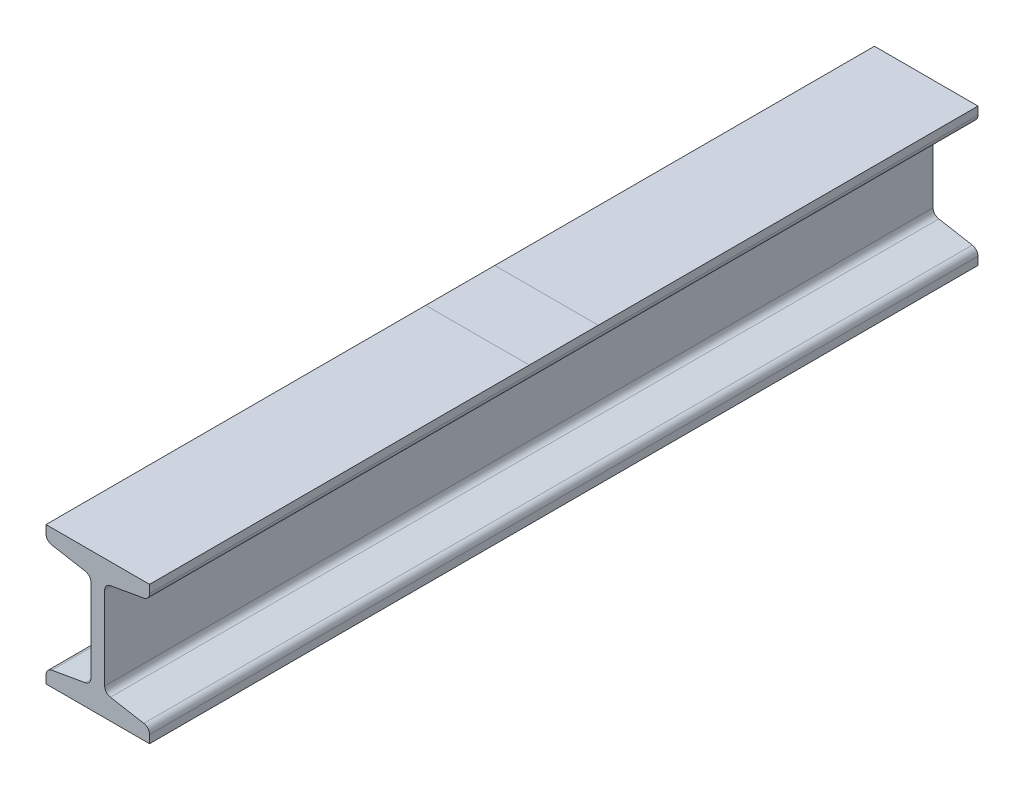
from build123d import *

# Parameters (mm, degrees)
BOSS_EXTRUDE1_DEPTH = 600
FILLET1_R           = 5


with BuildPart() as part:
    # Sketch1 → Boss-Extrude1 (new body)
    with BuildSketch(Plane.XY):
        Polygon((37.5, 50), (37.5, 40), (5, 34.269373127), (5, -34.269373127), (37.5, -40), (37.5, -50), (-37.5, -50), (-37.5, -40), (-5, -34.269373127), (-5, 34.269373127), (-37.5, 40), (-37.5, 50), align=None)
    extrude(amount=BOSS_EXTRUDE1_DEPTH)

    # Fillet1
    fillet1_edges = [part.edges().sort_by_distance(p)[0] for p in [
        (37.5, 40, 300),
        (5, 34.269373127, 300),
        (5, -34.269373127, 300),
        (37.5, -40, 300),
        (-37.5, -40, 300),
        (-5, -34.269373127, 300),
        (-5, 34.269373127, 300),
        (-37.5, 40, 300),
    ]]
    fillet(fillet1_edges, radius=FILLET1_R)


solid = part.part
